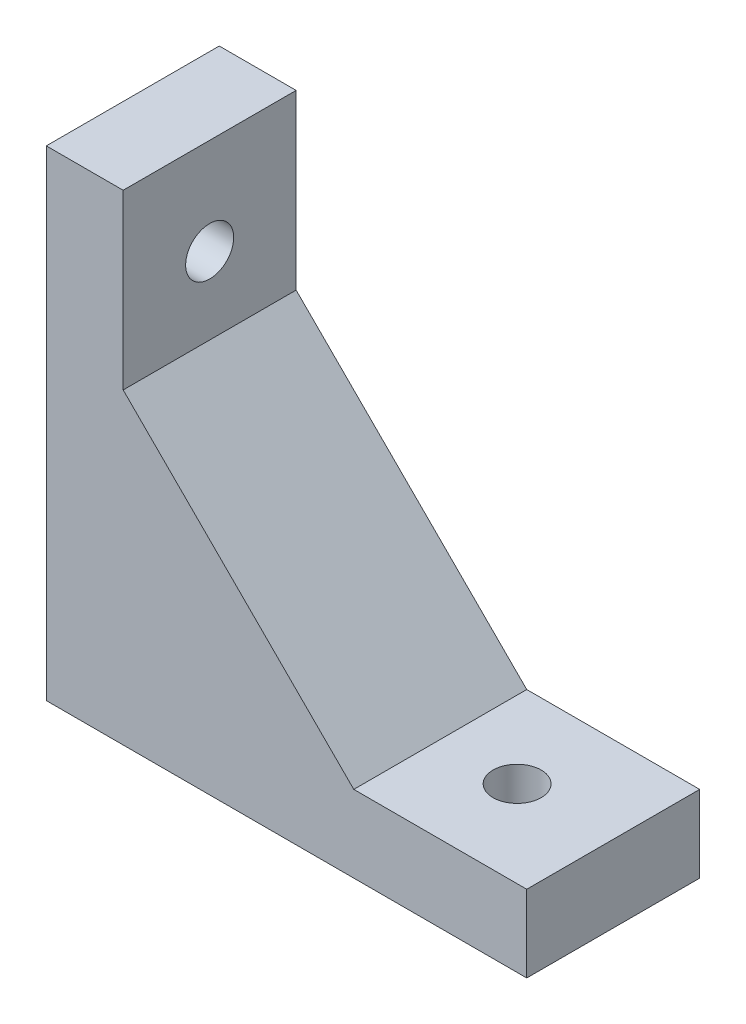
from build123d import *

# Parameters (mm, degrees)
EXTRUDE_1_DEPTH     = 18
SKETCH_2_R          = 2.5
CUT_EXTRUDE_1_DEPTH = 73.965745388
SKETCH_3_R          = 2.5
CUT_EXTRUDE_2_DEPTH = 73.965745388


with BuildPart() as part:
    # 草图1 → 凸台-拉伸1 (new body)
    with BuildSketch(Plane.XY):
        Polygon((32, 8), (50, 8), (50, 0), (0, 0), (0, 50), (8, 50), (8, 32), align=None)
    extrude(amount=EXTRUDE_1_DEPTH)

    # 草图2 → 切除-拉伸1 (cut, through all)
    with BuildSketch(Plane.XZ):
        with Locations(Location((40, 9, 0), (0, 0, 270))):
            Circle(SKETCH_2_R)
    extrude(amount=-CUT_EXTRUDE_1_DEPTH, mode=Mode.SUBTRACT)

    # 草图3 → 切除-拉伸2 (cut, through all)
    with BuildSketch(Plane.ZY):
        with Locations(Location((9, 40, 0), (0, 0, 270))):
            Circle(SKETCH_3_R)
    extrude(amount=-CUT_EXTRUDE_2_DEPTH, mode=Mode.SUBTRACT)


solid = part.part
